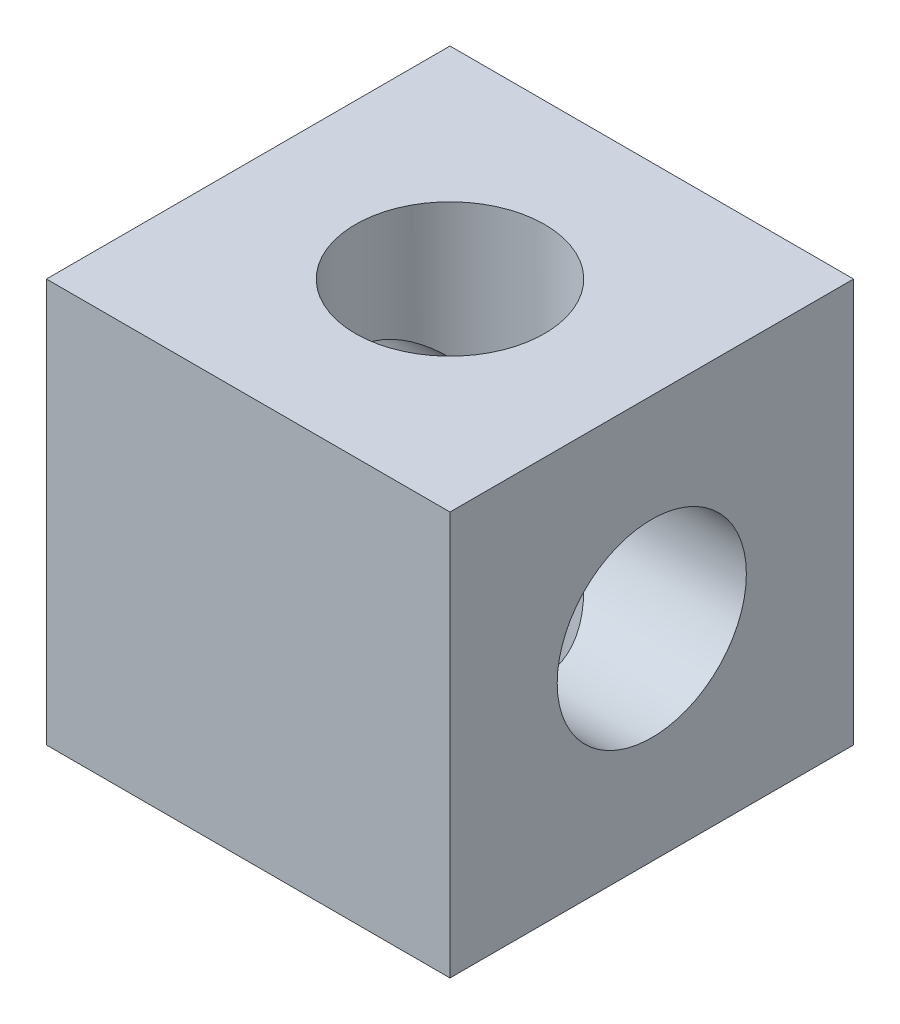
from build123d import *

# Parameters (mm, degrees)
SKETCH_1_W             = 20.32
SKETCH_1_H             = 20.32
EXTRUDE_1_DEPTH        = 20.32
HOLE_WIZARD_M8_1_D     = 9.525
HOLE_WIZARD_M8_2_D     = 9.525
HOLE_WIZARD_M8_2_DEPTH = 30.48


with BuildPart() as part:
    # 스케치1 → 보스-돌출1 (new body)
    with BuildSketch(Plane(origin=(10.16, 0, 0), x_dir=(0, 0, -1), z_dir=(1, 0, 0))):
        Rectangle(SKETCH_1_W, SKETCH_1_H)
    extrude(amount=-EXTRUDE_1_DEPTH)

    # M8 여유 구멍1 (through all)
    with Locations(Plane.ZY.offset(10.16)):
        with Locations((0, 0)):
            Hole(HOLE_WIZARD_M8_1_D / 2)

    # M8 여유 구멍2
    with Locations(Plane(origin=(0, 10.16, 0), x_dir=(1, 0, 0), z_dir=(0, 1, 0))):
        with Locations((0, 0)):
            Hole(HOLE_WIZARD_M8_2_D / 2, depth=HOLE_WIZARD_M8_2_DEPTH)


solid = part.part
